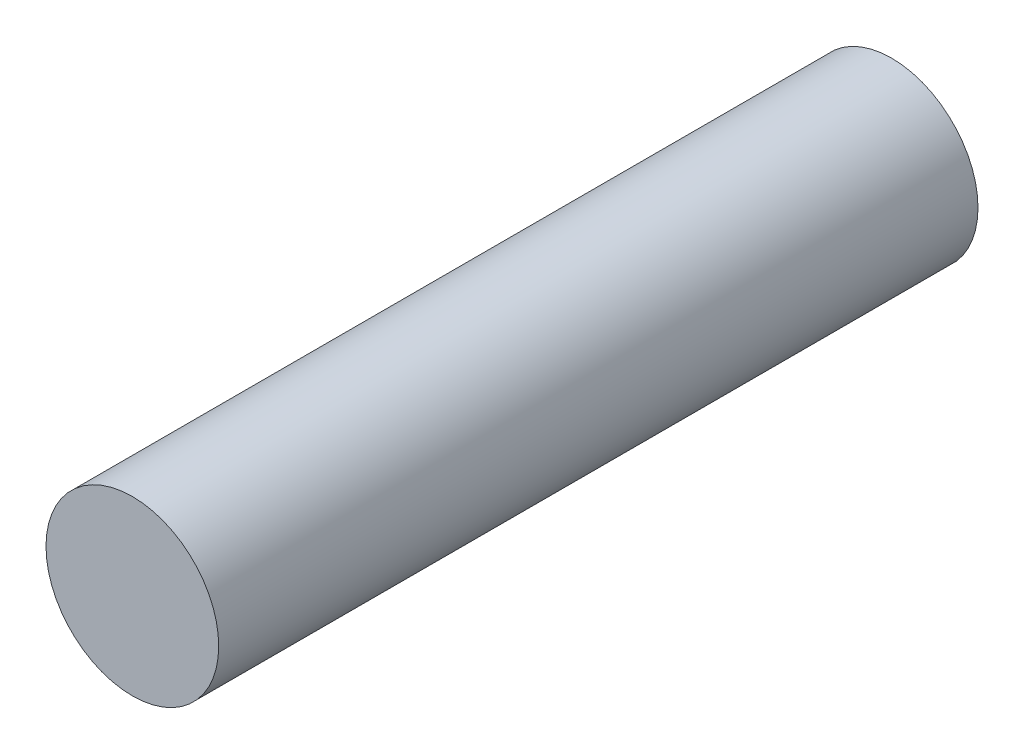
from build123d import *

# Parameters (mm, degrees)
SKETCH_2_R      = 8.075
EXTRUDE_1_DEPTH = 71


with BuildPart() as part:
    # 草图2 → 凸台-拉伸1 (new body)
    with BuildSketch(Plane.XY):
        with Locations((0.660445152, 8.680136282)):
            Circle(SKETCH_2_R)
    extrude(amount=EXTRUDE_1_DEPTH)


solid = part.part
